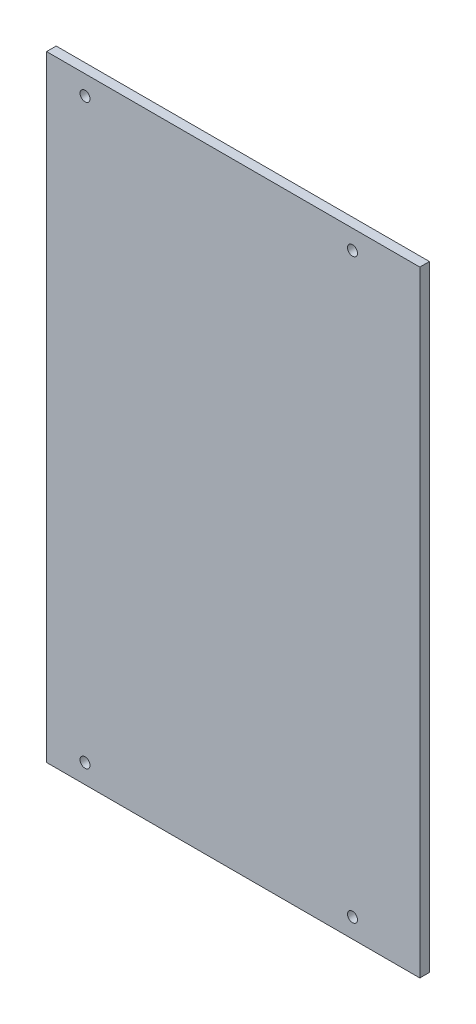
from build123d import *

# Parameters (mm, degrees)
SKETCH_1_W      = 194
SKETCH_1_H      = 320
SKETCH_1_R      = 2.6
EXTRUDE_1_DEPTH = 5


with BuildPart() as part:
    # 草图1 → 凸台-拉伸1 (new body)
    with BuildSketch(Plane.XY):
        with Locations((97, 160)):
            Rectangle(SKETCH_1_W, SKETCH_1_H)
        with Locations((20, 310)):
            Circle(SKETCH_1_R, mode=Mode.SUBTRACT)
        with Locations((159, 310)):
            Circle(SKETCH_1_R, mode=Mode.SUBTRACT)
        with Locations((159, 10)):
            Circle(SKETCH_1_R, mode=Mode.SUBTRACT)
        with Locations((20, 10)):
            Circle(SKETCH_1_R, mode=Mode.SUBTRACT)
    extrude(amount=EXTRUDE_1_DEPTH)


solid = part.part
